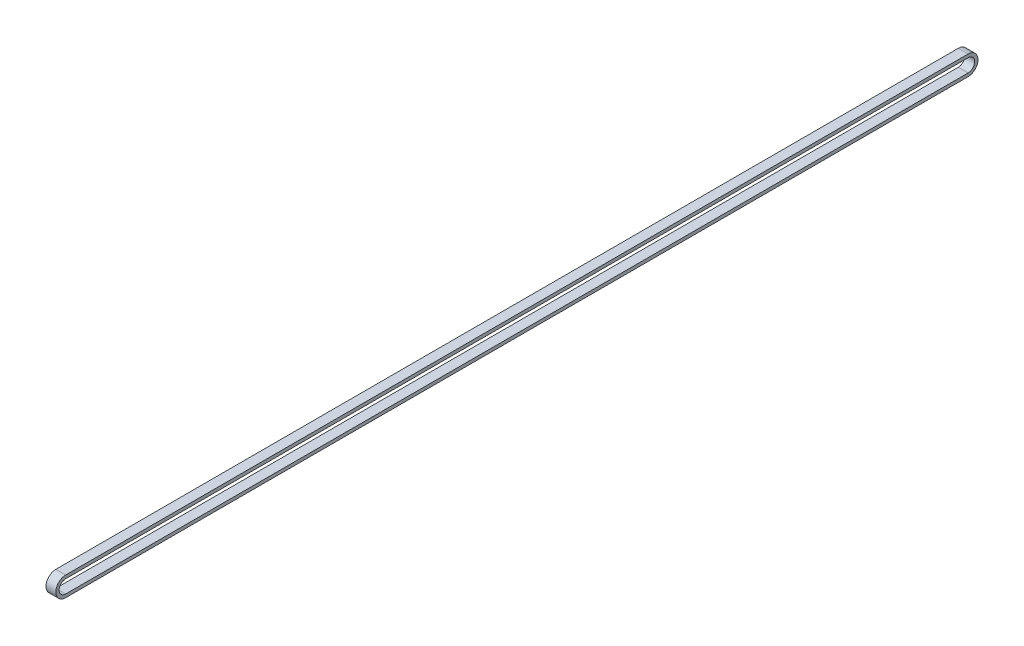
from build123d import *

# Parameters (mm, degrees)
EXTRUDE_1_DEPTH = 6


with BuildPart() as part:
    # 草图1 → 凸台-拉伸1 (new body)
    with BuildSketch(Plane(origin=(0, 0, 0), x_dir=(0, 0, -1), z_dir=(1, 0, 0))):
        with BuildLine():
            Line((0, 10), (550, 10))
            ThreePointArc((550, 10), (556, 4), (550, -2))
            Line((550, -2), (0, -2))
            ThreePointArc((0, -2), (-6, 4), (0, 10))
        make_face()
        with BuildLine():
            Line((0, 0), (550, 0))
            ThreePointArc((550, 0), (554, 4), (550, 8))
            Line((550, 8), (0, 8))
            ThreePointArc((0, 8), (-4, 4), (0, 0))
        make_face(mode=Mode.SUBTRACT)
    extrude(amount=EXTRUDE_1_DEPTH)


solid = part.part
